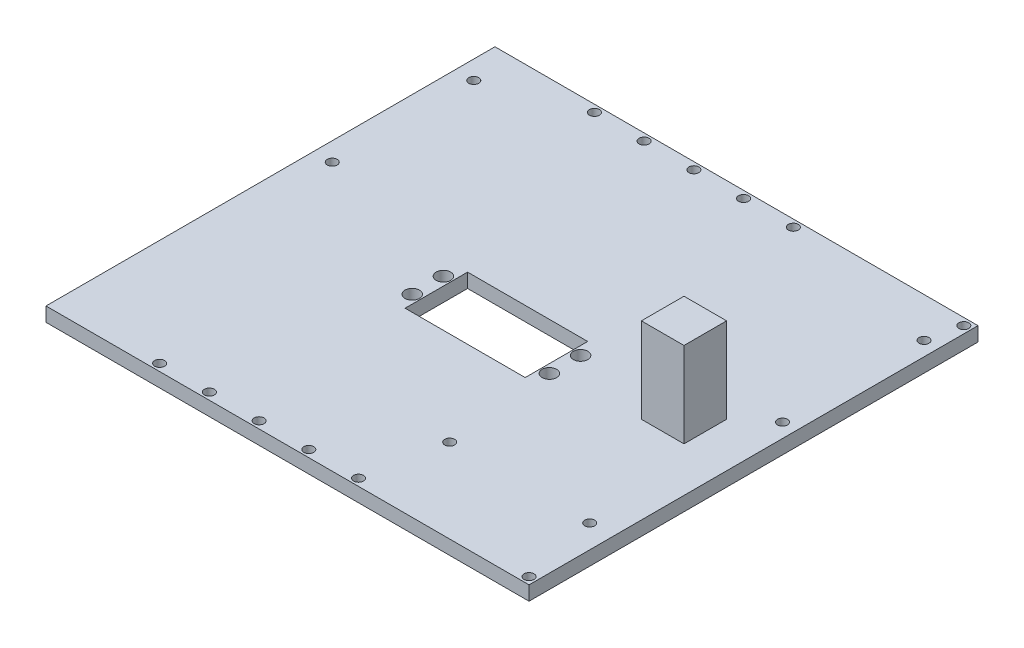
from build123d import *

# Parameters (mm, degrees)
SKETCH1_W           = 170
SKETCH1_H           = 158
SKETCH1_R           = 1.75
SKETCH1_R_2         = 2.55
SKETCH1_W_2         = 42.27
SKETCH1_H_2         = 22
BOSS_EXTRUDE1_DEPTH = 5
SKETCH2_W           = 15
SKETCH2_H           = 15
BOSS_EXTRUDE2_DEPTH = 30


with BuildPart() as part:
    # Sketch1 → Boss-Extrude1 (new body)
    with BuildSketch(Plane(origin=(0, 0, 0), x_dir=(1, 0, 0), z_dir=(0, 1, 0))):
        Rectangle(SKETCH1_W, SKETCH1_H)
        with Locations(Location((82.5, 76.5, 0), (0, 0, 270))):
            Circle(SKETCH1_R, mode=Mode.SUBTRACT)
        with Locations(Location((22.5, 76.5, 0), (0, 0, 270))):
            Circle(SKETCH1_R, mode=Mode.SUBTRACT)
        with Locations(Location((5, 76.5, 0), (0, 0, 270))):
            Circle(SKETCH1_R, mode=Mode.SUBTRACT)
        with Locations(Location((-12.5, 76.5, 0), (0, 0, 270))):
            Circle(SKETCH1_R, mode=Mode.SUBTRACT)
        with Locations(Location((-30, 76.5, 0), (0, 0, 270))):
            Circle(SKETCH1_R, mode=Mode.SUBTRACT)
        with Locations(Location((-47.5, 76.5, 0), (0, 0, 270))):
            Circle(SKETCH1_R, mode=Mode.SUBTRACT)
        with Locations(Location((82.5, -76.5, 0), (0, 0, 270))):
            Circle(SKETCH1_R, mode=Mode.SUBTRACT)
        with Locations(Location((22.5, -76.5, 0), (0, 0, 270))):
            Circle(SKETCH1_R, mode=Mode.SUBTRACT)
        with Locations(Location((5, -76.5, 0), (0, 0, 270))):
            Circle(SKETCH1_R, mode=Mode.SUBTRACT)
        with Locations(Location((-12.5, -76.5, 0), (0, 0, 270))):
            Circle(SKETCH1_R, mode=Mode.SUBTRACT)
        with Locations(Location((-30, -76.5, 0), (0, 0, 270))):
            Circle(SKETCH1_R, mode=Mode.SUBTRACT)
        with Locations(Location((-47.5, -76.5, 0), (0, 0, 270))):
            Circle(SKETCH1_R, mode=Mode.SUBTRACT)
        with Locations(Location((80, 15.2, 0), (0, 0, 270))):
            Circle(SKETCH1_R, mode=Mode.SUBTRACT)
        with Locations(Location((-78.46, 15.2, 0), (0, 0, 270))):
            Circle(SKETCH1_R, mode=Mode.SUBTRACT)
        with Locations(Location((24.14, -11, 0), (0, 0, 270))):
            Circle(SKETCH1_R_2, mode=Mode.SUBTRACT)
        with Locations(Location((24.14, 0, 0), (0, 0, 270))):
            Circle(SKETCH1_R_2, mode=Mode.SUBTRACT)
        with Locations(Location((-24.13, 0, 0), (0, 0, 270))):
            Circle(SKETCH1_R_2, mode=Mode.SUBTRACT)
        with Locations(Location((-24.13, -11, 0), (0, 0, 270))):
            Circle(SKETCH1_R_2, mode=Mode.SUBTRACT)
        with Locations(Location((80, 65, 0), (0, 0, 270))):
            Circle(SKETCH1_R, mode=Mode.SUBTRACT)
        with Locations(Location((-78.46, 65, 0), (0, 0, 270))):
            Circle(SKETCH1_R, mode=Mode.SUBTRACT)
        with Locations(Location((76.811114527, -49.46471284, 0), (0, 0, 270))):
            Circle(SKETCH1_R, mode=Mode.SUBTRACT)
        with Locations(Location((27.541114527, -49.46471284, 0), (0, 0, 270))):
            Circle(SKETCH1_R, mode=Mode.SUBTRACT)
        with Locations((0.005, -5.5)):
            Rectangle(SKETCH1_W_2, SKETCH1_H_2, mode=Mode.SUBTRACT)
    extrude(amount=BOSS_EXTRUDE1_DEPTH)

    # Sketch2 → Boss-Extrude2 (add)
    with BuildSketch(Plane(origin=(0, 5, 0), x_dir=(1, 0, 0), z_dir=(0, 1, 0))):
        with Locations((61.800323829, -1.270769853)):
            Rectangle(SKETCH2_W, SKETCH2_H)
    extrude(amount=BOSS_EXTRUDE2_DEPTH)


solid = part.part
